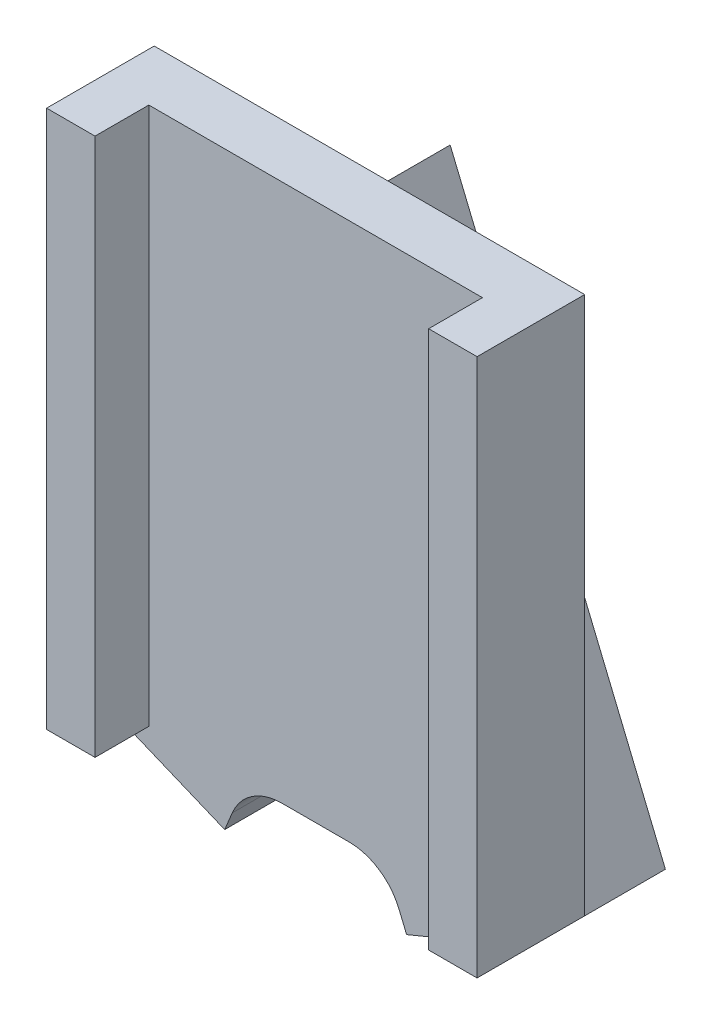
from build123d import *

# Parameters (mm, degrees)
SKETCH1_W                = 8
SKETCH1_H                = 10
BOSS_EXTRUDE1_DEPTH      = 2
SKETCH2_W                = 6.2
SKETCH2_H                = 10
CUT_EXTRUDE1_DEPTH       = 1
BOSS_EXTRUDE2_DEPTH      = 1.5
BOSS_EXTRUDE2_DEPTH_BACK = 1
M1_CLEARANCE_HOLE2_D     = 1.2
M1_CLEARANCE_HOLE2_DEPTH = 5
M1_CLEARANCE_HOLE2_TIP   = 0.360516371
M1_CLEARANCE_HOLE1_D     = 1
M1_CLEARANCE_HOLE1_DEPTH = 5
M1_CLEARANCE_HOLE1_TIP   = 0.30043031
SKETCH8_R                = 0.4
CUT_EXTRUDE2_DEPTH       = 1.5
FILLET2_R                = 1


with BuildPart() as part:
    # Sketch1 → Boss-Extrude1 (new body)
    with BuildSketch(Plane.XY):
        with Locations((4, -5)):
            Rectangle(SKETCH1_W, SKETCH1_H)
    extrude(amount=BOSS_EXTRUDE1_DEPTH)

    # Sketch2 → Cut-Extrude1 (cut)
    with BuildSketch(Plane.XY.offset(2)):
        with Locations((4, -5)):
            Rectangle(SKETCH2_W, SKETCH2_H)
    extrude(amount=-CUT_EXTRUDE1_DEPTH, mode=Mode.SUBTRACT)

    # Sketch3 → Boss-Extrude2 (add, two sides: drawn at the far end of the back side and taken through both)
    with BuildSketch(Plane(origin=(0, 0, 0), x_dir=(-1, 0, 0), z_dir=(0, 0, -1)).offset(-BOSS_EXTRUDE2_DEPTH_BACK)):
        Polygon((-8, -10), (-4, -0.343145751), (0, -10), (-2.309698831, -10.956708581), (-4, -6.875960575), (-5.690301169, -10.956708581), align=None)
    extrude(amount=BOSS_EXTRUDE2_DEPTH + BOSS_EXTRUDE2_DEPTH_BACK)

    # M1 Clearance Hole2
    with Locations(Plane(origin=(-3.535533906, -8.535533906, 0), x_dir=(-0.923879532511288, 0.38268343236508706, 0), z_dir=(-0.382683432365087, -0.9238795325112878, 0))):
        with Locations((-5.115994416, 0.25)):
            Hole(M1_CLEARANCE_HOLE2_D / 2, depth=M1_CLEARANCE_HOLE2_DEPTH)
            with Locations((0, 0, -(M1_CLEARANCE_HOLE2_DEPTH + M1_CLEARANCE_HOLE2_TIP / 2))):  # 118° drill point
                Cone(0, M1_CLEARANCE_HOLE2_D / 2, M1_CLEARANCE_HOLE2_TIP, mode=Mode.SUBTRACT)

    # M1 Clearance Hole1
    with Locations(Plane(origin=(4.707106781, -11.363961031, 0), x_dir=(-0.9238795325112875, -0.38268343236508784, 0), z_dir=(0.38268343236508784, -0.9238795325112875, 0))):
        with Locations((-2.314201936, 0.25)):
            Hole(M1_CLEARANCE_HOLE1_D / 2, depth=M1_CLEARANCE_HOLE1_DEPTH)
            with Locations((0, 0, -(M1_CLEARANCE_HOLE1_DEPTH + M1_CLEARANCE_HOLE1_TIP / 2))):  # 118° drill point
                Cone(0, M1_CLEARANCE_HOLE1_D / 2, M1_CLEARANCE_HOLE1_TIP, mode=Mode.SUBTRACT)

    # Sketch8 → Cut-Extrude2 (cut)
    with BuildSketch(Plane(origin=(0, 0, -1.5), x_dir=(-1, 0, 0), z_dir=(0, 0, -1))):
        with Locations((-4, -7.3)):
            Circle(SKETCH8_R)
    extrude(amount=-CUT_EXTRUDE2_DEPTH, mode=Mode.SUBTRACT)

    # Fillet2
    fillet2_edges = [part.edges().sort_by_distance(p)[0] for p in [
        (2.705980501, -10, 0.5),
        (5.294019499, -10, 0.5),
    ]]
    fillet(fillet2_edges, radius=FILLET2_R)


solid = part.part
